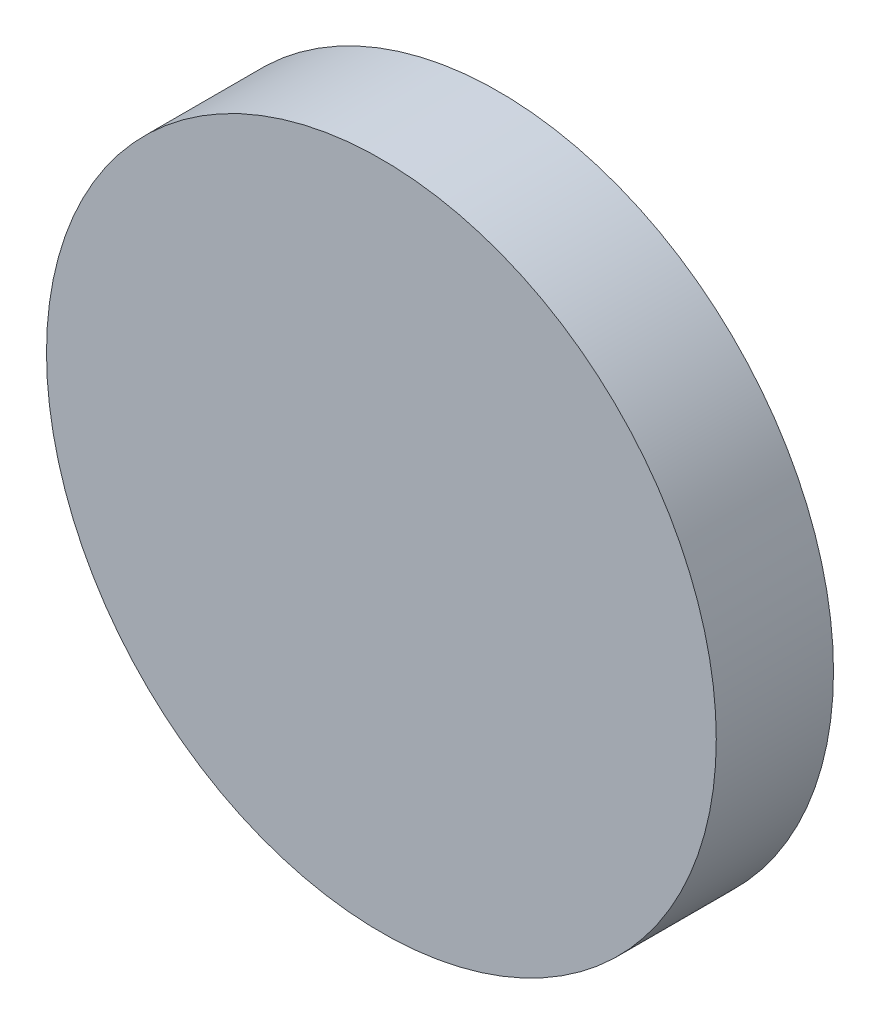
from build123d import *

# Parameters (mm, degrees)
SKETCH_1_R      = 10
EXTRUDE_1_DEPTH = 3.5


with BuildPart() as part:
    # 草图1 → 凸台-拉伸1 (new body)
    with BuildSketch(Plane.XY):
        Circle(SKETCH_1_R)
    extrude(amount=EXTRUDE_1_DEPTH)


solid = part.part
